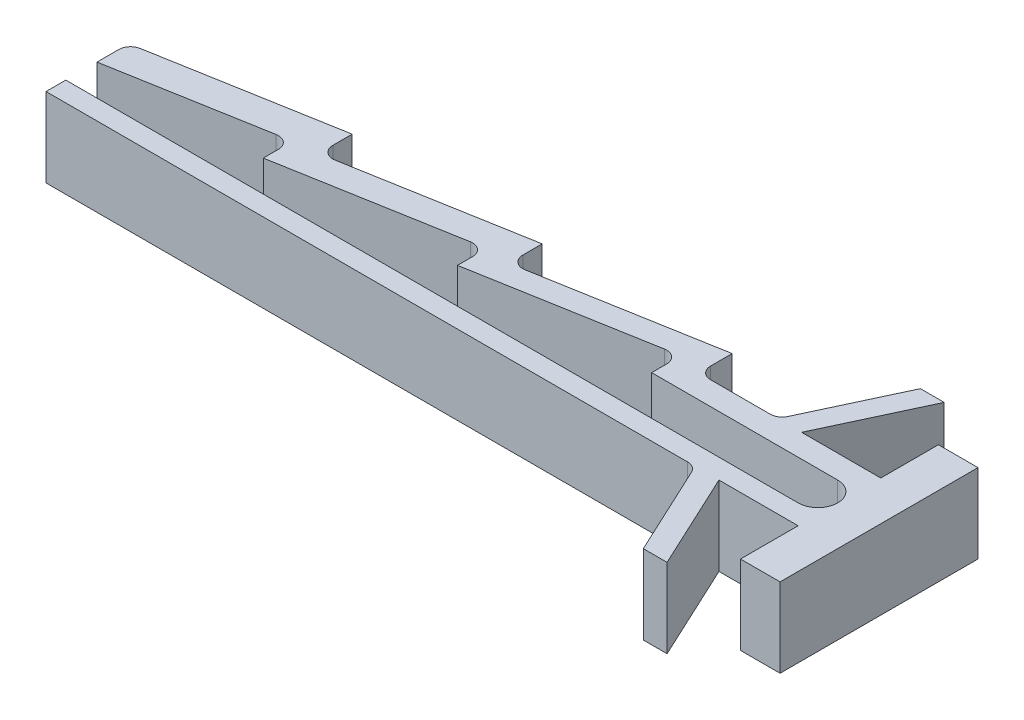
from build123d import *

# Parameters (mm, degrees)
BOSS_EXTRUDE1_DEPTH = 2
FILLET1_R           = 0.3


with BuildPart() as part:
    # Sketch1 → Boss-Extrude1 (new body)
    with BuildSketch(Plane(origin=(0, 0, 0), x_dir=(1, 0, 0), z_dir=(0, 1, 0))):
        with BuildLine():
            Line((0, 0), (0, 0.8))
            Line((0, 0.8), (4.8, 1.646369507))
            Line((4.8, 1.646369507), (4.8, 0.8))
            Line((4.8, 0.8), (9.6, 1.646369507))
            Line((9.6, 1.646369507), (9.6, 0.8))
            Line((9.6, 0.8), (14.4, 1.646369507))
            Line((14.4, 1.646369507), (14.4, 0.8))
            Line((14.4, 0.8), (16.4, 0.8))
            Line((16.4, 0.8), (17.54515657, 3.255796188))
            Line((17.54515657, 3.255796188), (18.14515657, 3.255796188))
            Line((18.14515657, 3.255796188), (17, 0.8))
            Line((17, 0.8), (19, 0.8))
            Line((19, 0.8), (19, 2.255796188))
            Line((19, 2.255796188), (20, 2.255796188))
            Line((20, 2.255796188), (20, -2.744203812))
            Line((20, -2.744203812), (19, -2.744203812))
            Line((19, -2.744203812), (19, -1.288407623))
            Line((19, -1.288407623), (17, -1.288407623))
            Line((17, -1.288407623), (18.14515657, -3.744203812))
            Line((18.14515657, -3.744203812), (17.54515657, -3.744203812))
            Line((17.54515657, -3.744203812), (16.4, -1.288407623))
            Line((16.4, -1.288407623), (0, -1.288407623))
            Line((0, -1.288407623), (0, -0.788407623))
            Line((0, -0.788407623), (18.5, -0.788407623))
            ThreePointArc((18.5, -0.788407623), (19, -0.288407623), (18.5, 0.211592377))
            Line((18.5, 0.211592377), (13.8, 0.211592377))
            Line((13.8, 0.211592377), (13.8, 0.952165696))
            Line((13.8, 0.952165696), (9, 0.105796188))
            Line((9, 0.105796188), (9, 0.846369507))
            Line((9, 0.846369507), (4.2, 0))
            Line((4.2, 0), (4.2, 0.740573319))
            Line((4.2, 0.740573319), (0, 0))
        make_face()
    extrude(amount=BOSS_EXTRUDE1_DEPTH)

    # Fillet1
    fillet1_edges = [part.edges().sort_by_distance(p)[0] for p in [
        (0, 1, -0.8),
        (4.8, 1, -0.8),
        (9.6, 1, -0.8),
        (14.4, 1, -0.8),
        (16.4, 1, -0.8),
        (16.4, 1, 1.288407623),
        (13.8, 1, -0.952165696),
        (9, 1, -0.846369507),
        (4.2, 1, -0.740573319),
    ]]
    fillet(fillet1_edges, radius=FILLET1_R)


solid = part.part
